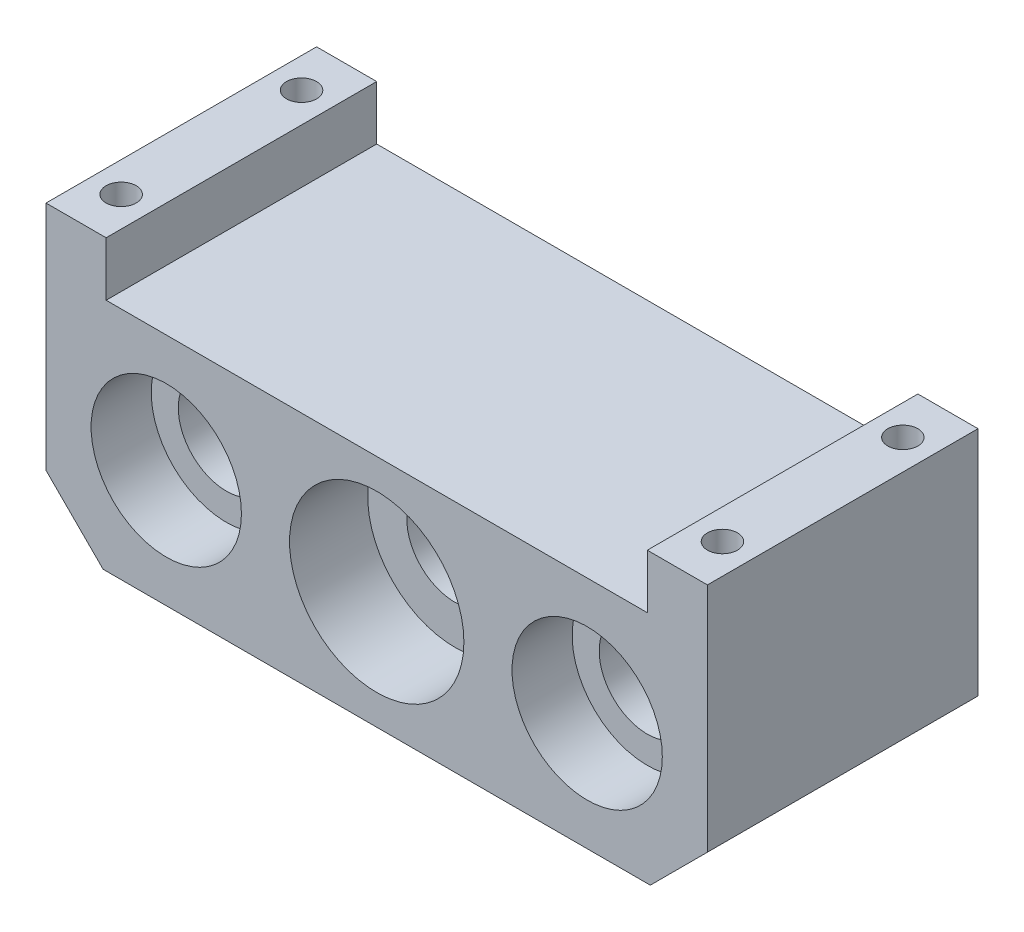
from build123d import *

# Parameters (mm, degrees)
BOSS_EXTRUDE1_DEPTH       = 45
M6X1_0_TAPPED_HOLE1_D     = 5
M6X1_0_TAPPED_HOLE1_DEPTH = 10
M6X1_0_TAPPED_HOLE1_TIP   = 1.502151548
SKETCH5_R                 = 12.5
SKETCH5_R_2               = 14.5
CUT_EXTRUDE1_DEPTH        = 10
SKETCH6_R                 = 14.5
CUT_EXTRUDE2_DEPTH        = 3
CUT_EXTRUDE3_DEPTH        = 86.755466298
CUT_EXTRUDE3_DEPTH_BACK   = 86.755466298
SKETCH7_R                 = 8
CIRPATTERN1_COUNT         = 8


with BuildPart() as part:
    # Sketch1 → Boss-Extrude1 (new body)
    with BuildSketch(Plane.XY):
        Polygon((-45.5, 0), (45.5, 0), (55, 9.5), (55, 48), (45, 48), (45, 39), (-45, 39), (-45, 48), (-55, 48), (-55, 9.5), align=None)
    extrude(amount=BOSS_EXTRUDE1_DEPTH)

    # M6x1.0 Tapped Hole1
    with Locations(Plane(origin=(0, 48, 0), x_dir=(1, 0, 0), z_dir=(0, 1, 0))):
        with Locations((-50, -7.5), (50, -7.5), (50, -37.5), (-50, -37.5)):
            Hole(M6X1_0_TAPPED_HOLE1_D / 2, depth=M6X1_0_TAPPED_HOLE1_DEPTH)
            with Locations((0, 0, -(M6X1_0_TAPPED_HOLE1_DEPTH + M6X1_0_TAPPED_HOLE1_TIP / 2))):  # 118° drill point
                Cone(0, M6X1_0_TAPPED_HOLE1_D / 2, M6X1_0_TAPPED_HOLE1_TIP, mode=Mode.SUBTRACT)

    # Sketch5 → Cut-Extrude1 (cut)
    with BuildSketch(Plane.XY.offset(45)):
        with Locations((-35, 19.5)):
            Circle(SKETCH5_R)
        with Locations((0, 19.5)):
            Circle(SKETCH5_R_2)
        with Locations((35, 19.5)):
            Circle(SKETCH5_R)
    extrude(amount=-CUT_EXTRUDE1_DEPTH, mode=Mode.SUBTRACT)

    # Sketch6 → Cut-Extrude2 (cut)
    with BuildSketch(Plane.XY.offset(35)):
        with Locations((0, 19.5)):
            Circle(SKETCH6_R)
    extrude(amount=-CUT_EXTRUDE2_DEPTH, mode=Mode.SUBTRACT)

    # Sketch7 → Cut-Extrude3 (cut, two sides: drawn at the far end of the back side and taken through both)
    with BuildSketch(Plane.XY.offset(-CUT_EXTRUDE3_DEPTH_BACK)):
        with Locations((0, 19.5)):
            Circle(SKETCH7_R)
        with Locations((35, 19.5)):
            Circle(SKETCH7_R)
        with Locations((-35, 19.5)):
            Circle(SKETCH7_R)
    extrude(amount=CUT_EXTRUDE3_DEPTH + CUT_EXTRUDE3_DEPTH_BACK, mode=Mode.SUBTRACT)

    # Sketch11 → M6x1.0 Tapped Hole2 (revolve, cut)
    with BuildSketch(Plane(origin=(19, 19.5, 0), x_dir=(0, 1, 0), z_dir=(1, 0, 0))):
        Polygon((0, 0), (0, 16.502151548), (2.5, 15), (2.5, 0), align=None)
    m6x1_0_tapped_hole2 = revolve(axis=Axis((19, 19.5, -6.35), (0, 0, 1)), mode=Mode.SUBTRACT)

    # CirPattern1: M6x1.0 Tapped Hole2 ×8 about axis, 2 skipped
    cirpattern1_axis = Axis((0, 19.5, 0), (0, 0, -1))
    add([m6x1_0_tapped_hole2.rotate(cirpattern1_axis, i * 360 / CIRPATTERN1_COUNT) for i in range(1, CIRPATTERN1_COUNT) if i not in (2, 6)], mode=Mode.SUBTRACT)


solid = part.part
